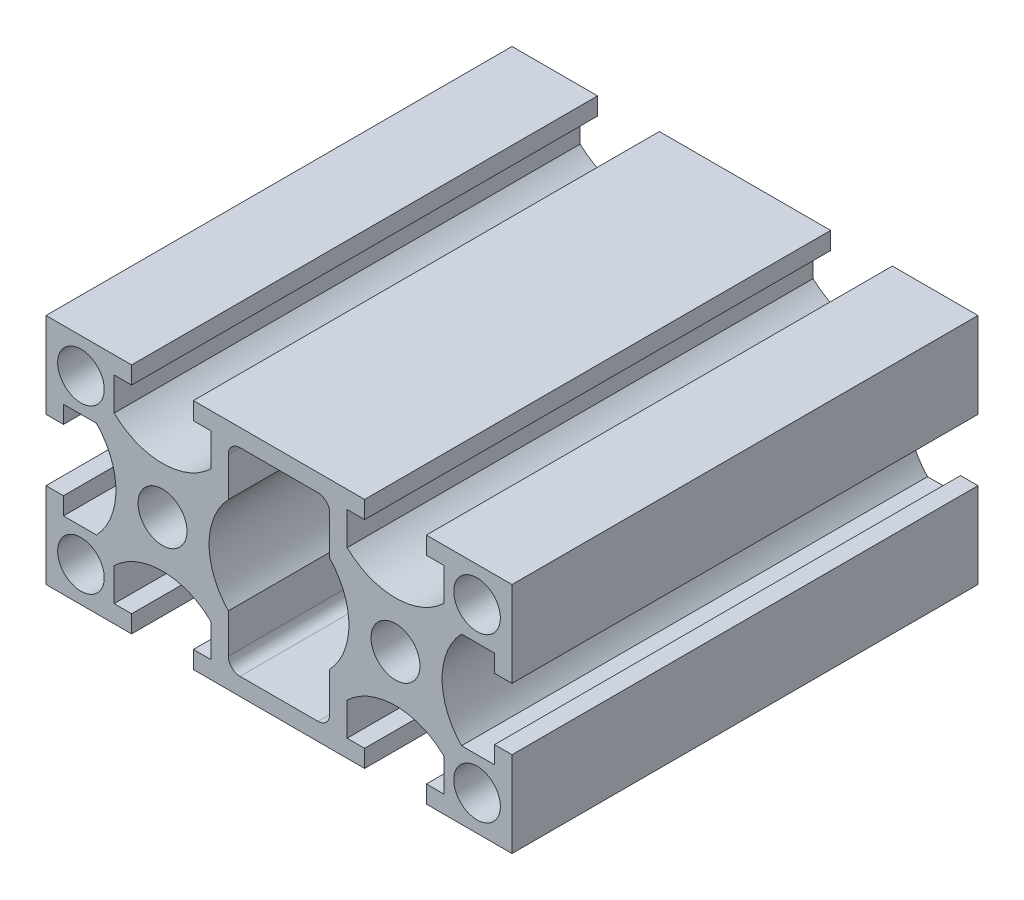
from build123d import *

# Parameters (mm, degrees)
SKETCH_1_W          = 40
SKETCH_1_H          = 20
EXTRUDE_1_DEPTH     = 40
SKETCH_2_R          = 2
SKETCH_2_R_2        = 6
SKETCH_2_R_3        = 2.1
CUT_EXTRUDE_1_DEPTH = 46.82575695
CUT_EXTRUDE_2_DEPTH = 46.82575695
CUT_EXTRUDE_3_DEPTH = 46.82575695


with BuildPart() as part:
    # 스케치1 → 보스-돌출1 (new body)
    with BuildSketch(Plane.XY):
        Rectangle(SKETCH_1_W, SKETCH_1_H)
    extrude(amount=EXTRUDE_1_DEPTH)

    # 스케치2 → 컷-돌출1 (cut, through all)
    with BuildSketch(Plane.XY.offset(40)):
        with Locations((-17, 7)):
            Circle(SKETCH_2_R)
        with Locations((-17, -7)):
            Circle(SKETCH_2_R)
        with Locations((17, -7)):
            Circle(SKETCH_2_R)
        with Locations((17, 7)):
            Circle(SKETCH_2_R)
        Circle(SKETCH_2_R_2)
        with Locations((-10, 0)):
            Circle(SKETCH_2_R_3)
        with Locations(Location((10, 0, 0), (0, 0, 180))):
            Circle(SKETCH_2_R_3)
    extrude(amount=-CUT_EXTRUDE_1_DEPTH, mode=Mode.SUBTRACT)

    # 스케치3 → 컷-돌출2 (cut, through all)
    with BuildSketch(Plane(origin=(0, 0, 0), x_dir=(-1, 0, 0), z_dir=(0, 0, -1))):
        with BuildLine():
            Line((-20, 2.65), (-20, -2.65))
            Line((-20, -2.65), (-18.5, -2.65))
            Line((-18.5, -2.65), (-18.5, -4.15))
            Line((-18.5, -4.15), (-15.666698718, -4.15))
            ThreePointArc((-15.666698718, -4.15), (-14, 0), (-15.666698718, 4.15))
            Line((-15.666698718, 4.15), (-18.5, 4.15))
            Line((-18.5, 4.15), (-18.5, 2.65))
            Line((-18.5, 2.65), (-20, 2.65))
        make_face()
        with BuildLine():
            Line((-14.15, 8.5), (-14.15, 5.666698718))
            ThreePointArc((-14.15, 5.666698718), (-10, 4), (-5.85, 5.666698718))
            Line((-5.85, 5.666698718), (-5.85, 8.5))
            Line((-5.85, 8.5), (-7.35, 8.5))
            Line((-7.35, 8.5), (-7.35, 10))
            Line((-7.35, 10), (-12.65, 10))
            Line((-12.65, 10), (-12.65, 8.5))
            Line((-12.65, 8.5), (-14.15, 8.5))
        make_face()
        with BuildLine():
            Line((-12.65, -8.5), (-14.15, -8.5))
            Line((-14.15, -8.5), (-14.15, -5.666698718))
            ThreePointArc((-14.15, -5.666698718), (-10, -4), (-5.85, -5.666698718))
            Line((-5.85, -5.666698718), (-5.85, -8.5))
            Line((-5.85, -8.5), (-7.35, -8.5))
            Line((-7.35, -8.5), (-7.35, -10))
            Line((-7.35, -10), (-12.65, -10))
            Line((-12.65, -10), (-12.65, -8.5))
        make_face()
        with BuildLine():
            Line((14.15, -8.5), (14.15, -5.666698718))
            ThreePointArc((14.15, -5.666698718), (10, -4), (5.85, -5.666698718))
            Line((5.85, -5.666698718), (5.85, -8.5))
            Line((5.85, -8.5), (7.35, -8.5))
            Line((7.35, -8.5), (7.35, -10))
            Line((7.35, -10), (12.65, -10))
            Line((12.65, -10), (12.65, -8.5))
            Line((12.65, -8.5), (14.15, -8.5))
        make_face()
        with BuildLine():
            Line((12.65, 8.5), (14.15, 8.5))
            Line((14.15, 8.5), (14.15, 5.666698718))
            ThreePointArc((14.15, 5.666698718), (10, 4), (5.85, 5.666698718))
            Line((5.85, 5.666698718), (5.85, 8.5))
            Line((5.85, 8.5), (7.35, 8.5))
            Line((7.35, 8.5), (7.35, 10))
            Line((7.35, 10), (12.65, 10))
            Line((12.65, 10), (12.65, 8.5))
        make_face()
        with BuildLine():
            Line((18.5, -4.15), (15.666698718, -4.15))
            ThreePointArc((15.666698718, -4.15), (14, 0), (15.666698718, 4.15))
            Line((15.666698718, 4.15), (18.5, 4.15))
            Line((18.5, 4.15), (18.5, 2.65))
            Line((18.5, 2.65), (20, 2.65))
            Line((20, 2.65), (20, -2.65))
            Line((20, -2.65), (18.5, -2.65))
            Line((18.5, -2.65), (18.5, -4.15))
        make_face()
    extrude(amount=-CUT_EXTRUDE_2_DEPTH, mode=Mode.SUBTRACT)

    # 스케치4 → 컷-돌출3 (cut, through all)
    with BuildSketch(Plane(origin=(0, 0, 0), x_dir=(-1, 0, 0), z_dir=(0, 0, -1))):
        with BuildLine():
            Line((-3.35, 8.5), (3.35, 8.5))
            ThreePointArc((3.35, 8.5), (4.057106781, 8.207106781), (4.35, 7.5))
            Line((4.35, 7.5), (4.35, -7.5))
            ThreePointArc((4.35, -7.5), (4.057106781, -8.207106781), (3.35, -8.5))
            Line((3.35, -8.5), (-3.35, -8.5))
            ThreePointArc((-3.35, -8.5), (-4.057106781, -8.207106781), (-4.35, -7.5))
            Line((-4.35, -7.5), (-4.35, 7.5))
            ThreePointArc((-4.35, 7.5), (-4.057106781, 8.207106781), (-3.35, 8.5))
        make_face()
    extrude(amount=-CUT_EXTRUDE_3_DEPTH, mode=Mode.SUBTRACT)


solid = part.part
